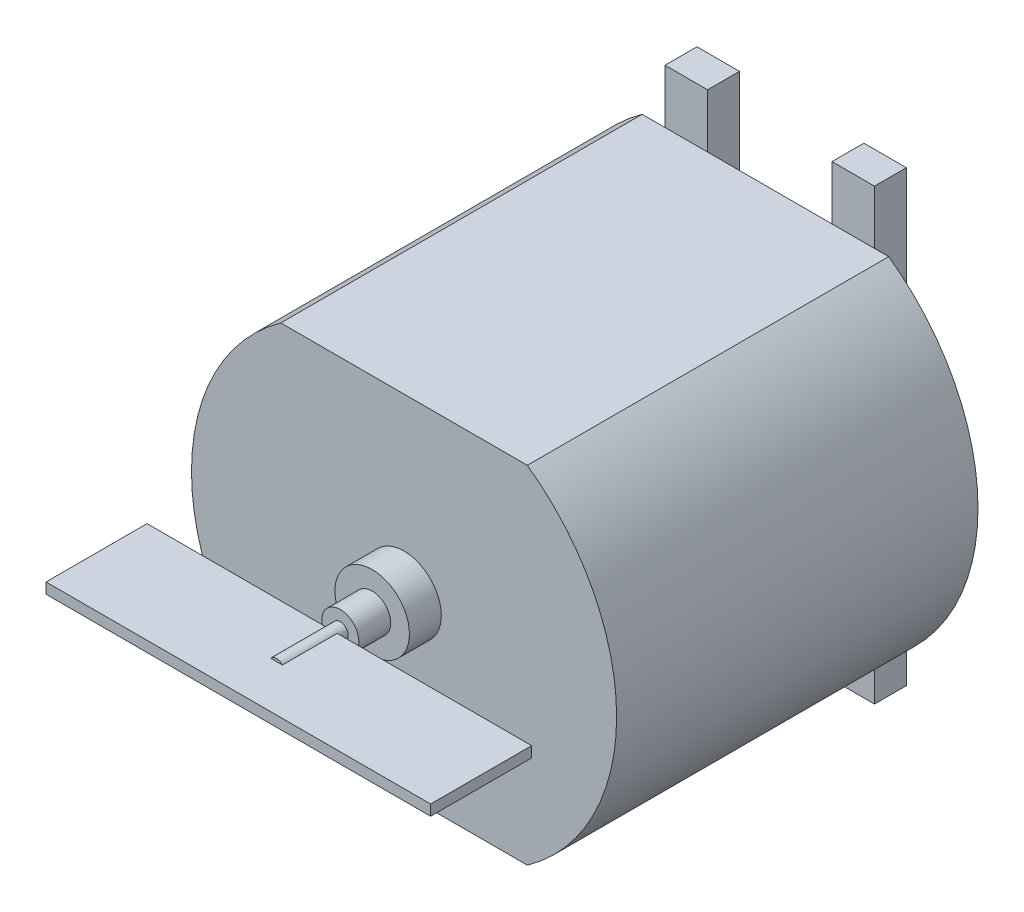
from build123d import *

# Parameters (mm, degrees)
BOSS_EXTRUDE1_DEPTH      = 34
SKETCH2_R                = 3.503672553
BOSS_EXTRUDE2_DEPTH      = 3
SKETCH3_R                = 1.746279777
BOSS_EXTRUDE3_DEPTH      = 3
SKETCH4_R                = 0.749347306
BOSS_EXTRUDE4_DEPTH      = 6
SKETCH5_W                = 4
SKETCH5_H                = 42.204508387
BOSS_EXTRUDE5_DEPTH      = 3
BOSS_EXTRUDE7_DEPTH      = 0.5
BOSS_EXTRUDE7_DEPTH_BACK = 0.5
SKETCH7_W                = 36.186676628
SKETCH7_H                = 9.506502519


with BuildPart() as part:
    # Sketch1 → Boss-Extrude1 (new body)
    with BuildSketch(Plane.XY):
        with BuildLine():
            Line((-11.599484275, 16.292696663), (11.599484275, 16.292696663))
            ThreePointArc((11.599484275, 16.292696663), (20, 0), (11.599484275, -16.292696663))
            Line((11.599484275, -16.292696663), (-11.599484275, -16.292696663))
            ThreePointArc((-11.599484275, -16.292696663), (-20, 0), (-11.599484275, 16.292696663))
        make_face()
    extrude(amount=BOSS_EXTRUDE1_DEPTH)

    # Sketch2 → Boss-Extrude2 (add)
    with BuildSketch(Plane.XY.offset(34)):
        Circle(SKETCH2_R)
    extrude(amount=BOSS_EXTRUDE2_DEPTH)

    # Sketch3 → Boss-Extrude3 (add)
    with BuildSketch(Plane.XY.offset(37)):
        Circle(SKETCH3_R)
    extrude(amount=BOSS_EXTRUDE3_DEPTH)

    # Sketch4 → Boss-Extrude4 (add)
    with BuildSketch(Plane.XY.offset(40)):
        Circle(SKETCH4_R)
    extrude(amount=BOSS_EXTRUDE4_DEPTH)

    # Sketch5 → Boss-Extrude5 (add)
    with BuildSketch(Plane(origin=(0, 0, 0), x_dir=(-1, 0, 0), z_dir=(0, 0, -1))):
        with Locations((-8.261138403, 0.267681872)):
            Rectangle(SKETCH5_W, SKETCH5_H)
        with Locations((7.442864718, 0.267681872)):
            Rectangle(SKETCH5_W, SKETCH5_H)
    extrude(amount=BOSS_EXTRUDE5_DEPTH)

    # Sketch7 → Boss-Extrude7 (add, two sides: drawn at the far end of the back side and taken through both)
    with BuildSketch(Plane(origin=(0, 0, 0), x_dir=(1, 0, 0), z_dir=(0, 1, 0)).offset(-BOSS_EXTRUDE7_DEPTH_BACK)):
        with Locations((0.761824771, -45.603600446)):
            Rectangle(SKETCH7_W, SKETCH7_H)
    extrude(amount=BOSS_EXTRUDE7_DEPTH + BOSS_EXTRUDE7_DEPTH_BACK)


solid = part.part
